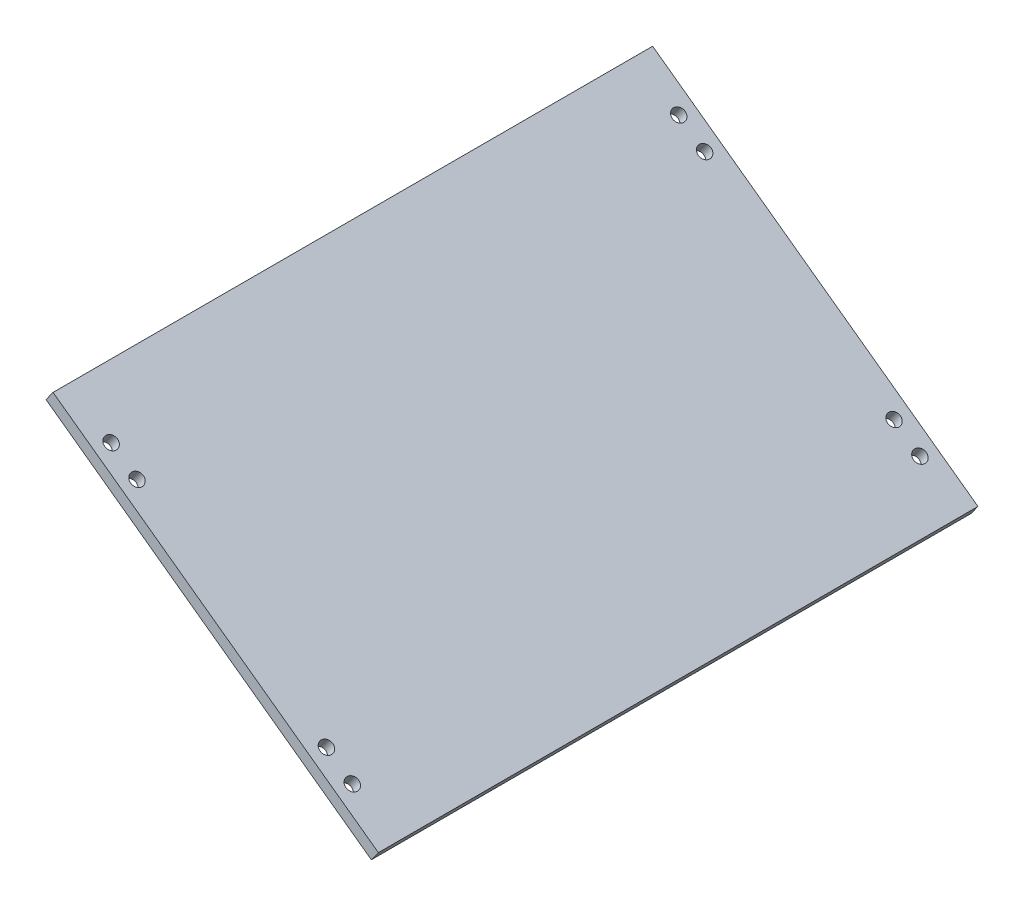
from build123d import *

# Parameters (mm, degrees)
SKETCH_2_W      = 100.501056251
SKETCH_2_H      = 149.951645819
SKETCH_2_R      = 1.6
EXTRUDE_1_DEPTH = 3


with BuildPart() as part:
    # 草图2 → 凸台-拉伸1 (new body)
    with BuildSketch(Plane(origin=(58.724000156, 80.989637793, 0), x_dir=(0.8095795047809408, -0.5870102430440604, 0), z_dir=(0.5870102430440604, 0.8095795047809408, 0))):
        with Locations((-8.300782896, -27.864106314)):
            Rectangle(SKETCH_2_W, SKETCH_2_H)
        with Locations(Location((-45.551311022, 43.111716595, 0), (0, 0, 180))):
            Circle(SKETCH_2_R, mode=Mode.SUBTRACT)
        with Locations(Location((-37.551311022, 43.111716595, 0), (0, 0, 180))):
            Circle(SKETCH_2_R, mode=Mode.SUBTRACT)
        with Locations(Location((20.949745229, 43.111716595, 0), (0, 0, 180))):
            Circle(SKETCH_2_R, mode=Mode.SUBTRACT)
        with Locations(Location((28.949745229, 43.111716595, 0), (0, 0, 180))):
            Circle(SKETCH_2_R, mode=Mode.SUBTRACT)
        with Locations((28.949745229, -98.839929224)):
            Circle(SKETCH_2_R, mode=Mode.SUBTRACT)
        with Locations((20.949745229, -98.839929224)):
            Circle(SKETCH_2_R, mode=Mode.SUBTRACT)
        with Locations((-37.551311022, -98.839929224)):
            Circle(SKETCH_2_R, mode=Mode.SUBTRACT)
        with Locations((-45.551311022, -98.839929224)):
            Circle(SKETCH_2_R, mode=Mode.SUBTRACT)
    extrude(amount=-EXTRUDE_1_DEPTH)


solid = part.part
